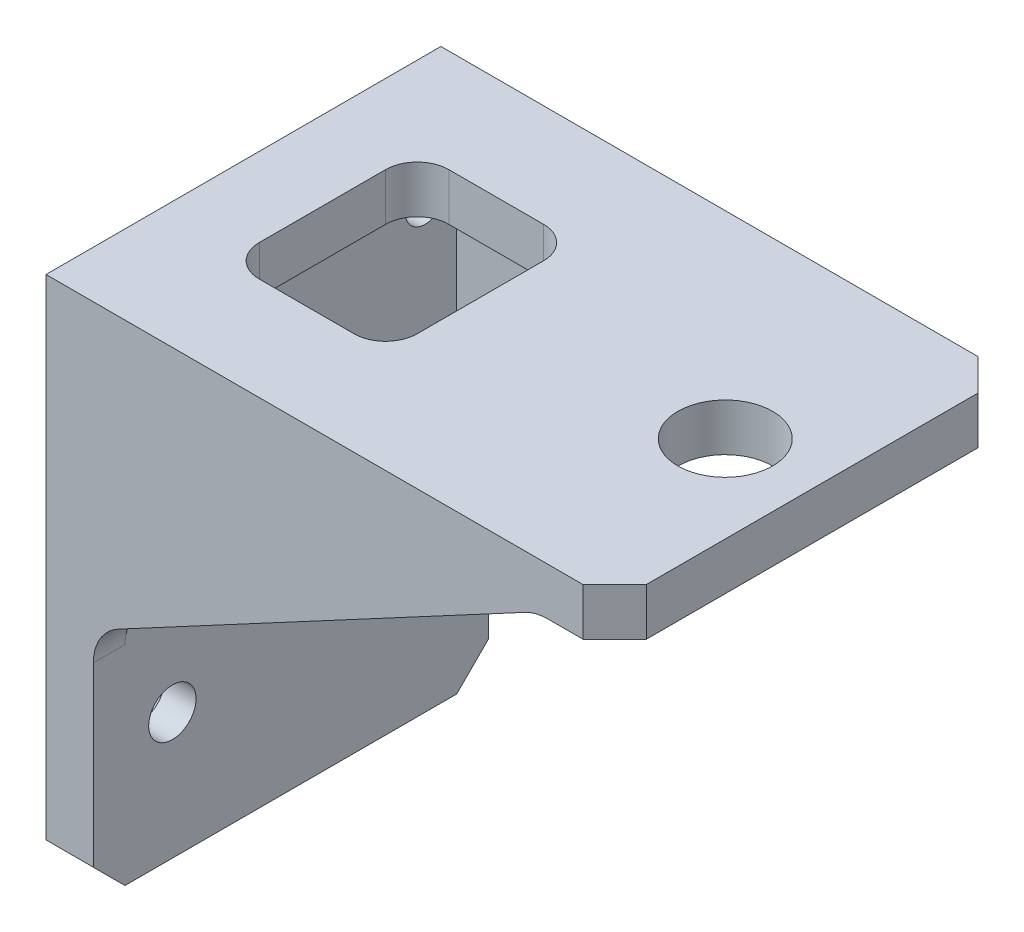
from build123d import *

# Parameters (mm, degrees)
EXTRUDE_1_DEPTH     = 25
SKETCH_2_R          = 1.5
CUT_EXTRUDE_1_DEPTH = 55.863466897
HOLE_WIZARD_M3_1_D  = 2.5
CHAMFER_1_SIZE      = 1
SKETCH_5_R          = 3
CUT_EXTRUDE_2_DEPTH = 25
CUT_EXTRUDE_3_REACH = 56.863
SKETCH_6_W          = 10
SKETCH_6_H          = 12
FILLET_1_R          = 2
CHAMFER_2_SIZE      = 2
RIB_2_REACH         = 56.863
SKETCH_7_WALL_W     = 143.491694144
SKETCH_7_WALL_H     = 2
RIB_3_REACH         = 56.863
SKETCH_8_WALL_W     = 143.491694144
SKETCH_8_WALL_H     = 2
FILLET_2_R          = 2
FILLET_3_R          = 3


with BuildPart() as part:
    # 草图1 → 凸台-拉伸1 (new body)
    with BuildSketch(Plane.XY):
        Polygon((3, 30), (36, 30), (36, 33), (0, 33), (0, 0), (3, 0), align=None)
    extrude(amount=EXTRUDE_1_DEPTH)

    # 草图2 → 切除-拉伸1 (cut, through all)
    with BuildSketch(Plane.ZY):
        with Locations((5, 18)):
            Circle(SKETCH_2_R)
        with Locations((20, 18)):
            Circle(SKETCH_2_R)
        with Locations((20, 8)):
            Circle(SKETCH_2_R)
        with Locations((5, 8)):
            Circle(SKETCH_2_R)
    extrude(amount=-CUT_EXTRUDE_1_DEPTH, mode=Mode.SUBTRACT)

    # M3 螺纹孔1 (through all)
    with Locations(Plane(origin=(0, 28, 4), x_dir=(0, 0, -1), z_dir=(-1, 0, 0))):
        with Locations((0, 0), (-17, 0)):
            Hole(HOLE_WIZARD_M3_1_D / 2)

    # 倒角1
    chamfer_1_edges = [part.edges().sort_by_distance(p)[0] for p in [
        (0, 8, 18.5),
        (0, 8, 3.5),
    ]]
    chamfer(chamfer_1_edges, length=CHAMFER_1_SIZE)

    # 草图5 → 切除-拉伸2 (cut)
    with BuildSketch(Plane(origin=(0, 33, 0), x_dir=(1, 0, 0), z_dir=(0, 1, 0))):
        with Locations(Location((30.5, -12.5, 0), (0, 0, 180))):
            Circle(SKETCH_5_R)
    extrude(amount=-CUT_EXTRUDE_2_DEPTH, mode=Mode.SUBTRACT)

    # 草图6 → 切除-拉伸3 (cut, up to next)
    with BuildSketch(Plane(origin=(0, 33, 0), x_dir=(1, 0, 0), z_dir=(0, 1, 0)), mode=Mode.PRIVATE) as cut_extrude_3_sk1:
        with Locations((10, -12.5)):
            Rectangle(SKETCH_6_W, SKETCH_6_H)
    cut_extrude_3_tool1 = extrude(cut_extrude_3_sk1.sketch, amount=-CUT_EXTRUDE_3_REACH, mode=Mode.PRIVATE) & part.part
    add(cut_extrude_3_tool1.solids().sort_by_distance((10, 33, 12.5))[0], mode=Mode.SUBTRACT)

    # 圆角1
    fillet_1_edges = [part.edges().sort_by_distance(p)[0] for p in [
        (15, 31.5, 6.5),
        (15, 31.5, 18.5),
        (5, 31.5, 18.5),
        (5, 31.5, 6.5),
    ]]
    fillet(fillet_1_edges, radius=FILLET_1_R)

    # 倒角2
    chamfer_2_edges = [part.edges().sort_by_distance(p)[0] for p in [
        (36, 31.5, 25),
        (36, 31.5, 0),
        (1.5, 0, 25),
        (1.5, 0, 0),
    ]]
    chamfer(chamfer_2_edges, length=CHAMFER_2_SIZE)

    # 草图7 wall → 筋2 (add, up to next)
    with BuildSketch(Plane(origin=(17, 22.5, 25), x_dir=(0.881479970029, 0.472221412515, 0), z_dir=(-0.472221412515, 0.881479970029, 0)), mode=Mode.PRIVATE) as rib_2_sk1:
        with Locations((0, 1)):
            Rectangle(SKETCH_7_WALL_W, SKETCH_7_WALL_H)
    rib_2_tool1 = extrude(rib_2_sk1.sketch, amount=RIB_2_REACH, mode=Mode.PRIVATE) - part.part
    add(rib_2_tool1.solids().sort_by_distance((17, 22.5, 25))[0])

    # 草图8 wall → 筋3 (add, up to next)
    with BuildSketch(Plane(origin=(17, 22.5, 0), x_dir=(0.881479970029, 0.472221412515, 0), z_dir=(0.472221412515, -0.881479970029, 0)), mode=Mode.PRIVATE) as rib_3_sk1:
        with Locations((0, 1)):
            Rectangle(SKETCH_8_WALL_W, SKETCH_8_WALL_H)
    rib_3_tool1 = extrude(rib_3_sk1.sketch, amount=-RIB_3_REACH, mode=Mode.PRIVATE) - part.part
    add(rib_3_tool1.solids().sort_by_distance((17, 22.5, 0))[0])

    # 圆角2
    fillet_2_edges = [part.edges().sort_by_distance(p)[0] for p in [
        (17, 30, 23),
        (17, 30, 2),
    ]]
    fillet(fillet_2_edges, radius=FILLET_2_R)

    # 圆角3
    fillet_3_edges = [part.edges().sort_by_distance(p)[0] for p in [
        (31, 30, 2),
        (31, 30, 23),
        (3, 15, 24),
        (3, 15, 1),
    ]]
    fillet(fillet_3_edges, radius=FILLET_3_R)


solid = part.part
